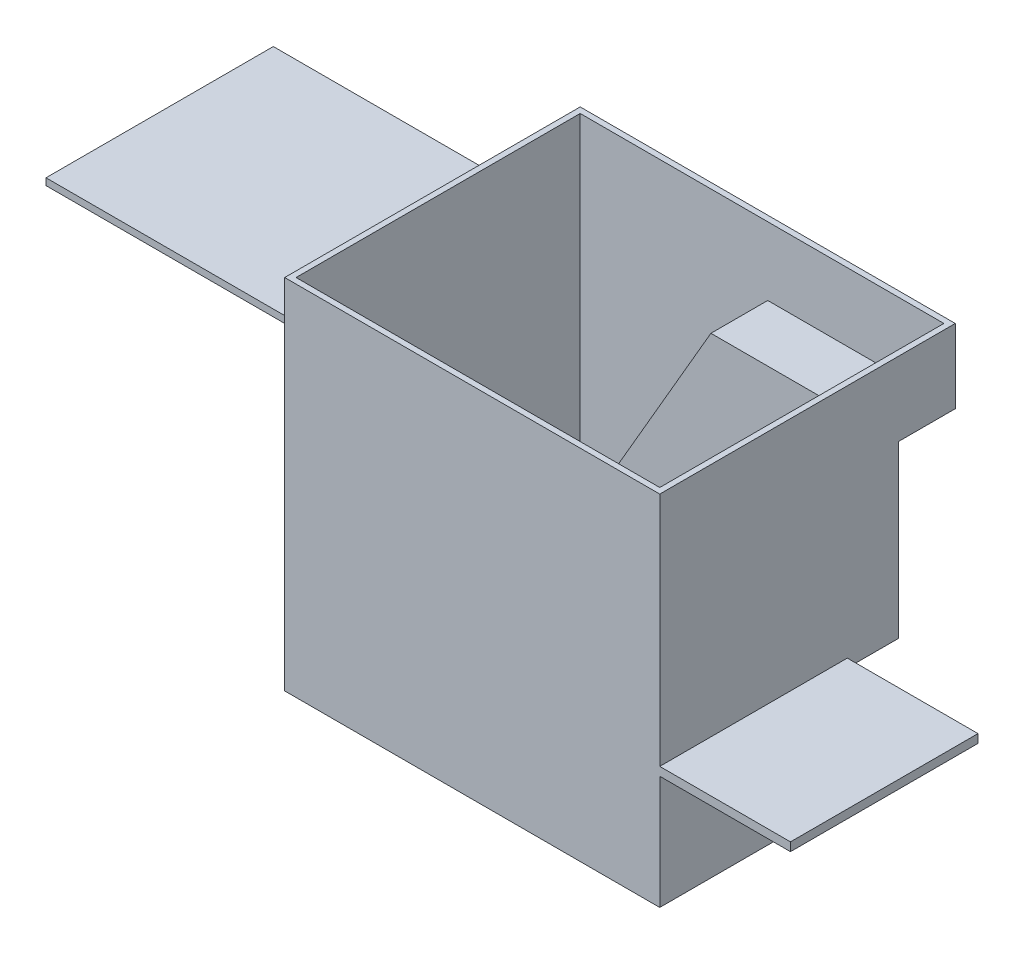
from build123d import *

# Parameters (mm, degrees)
EXTRUDE_1_DEPTH     = 10
SKETCH_2_W          = 10
SKETCH_2_H          = 510
EXTRUDE_2_DEPTH     = 500
EXTRUDE_3_DEPTH     = 10
EXTRUDE_4_DEPTH     = 190
SKETCH_5_W          = 640
SKETCH_5_H          = 10
EXTRUDE_5_DEPTH     = 200
CUT_EXTRUDE_1_DEPTH = 20
SKETCH_7_W          = 523.996532841
SKETCH_7_H          = 100
EXTRUDE_7_DEPTH     = 10
EXTRUDE_8_DEPTH     = 100
EXTRUDE_9_DEPTH     = 10
EXTRUDE_10_DEPTH    = 10
SKETCH_11_W         = 810
SKETCH_11_H         = 510
EXTRUDE_11_DEPTH    = 10
SKETCH_12_W         = 520
SKETCH_12_H         = 510
CUT_EXTRUDE_2_DEPTH = 120
SKETCH_13_W         = 520
SKETCH_13_H         = 510
CUT_EXTRUDE_3_DEPTH = 50
EXTRUDE_12_DEPTH    = 10
SKETCH_15_W         = 520
SKETCH_15_H         = 510
EXTRUDE_13_DEPTH    = 10
EXTRUDE_15_DEPTH    = 100
SKETCH_18_W         = 660
SKETCH_18_H         = 520
SKETCH_18_W_2       = 640
SKETCH_18_H_2       = 500
EXTRUDE_16_DEPTH    = 120
SKETCH_19_W         = 400
SKETCH_19_H         = 12
EXTRUDE_17_DEPTH    = 480
SKETCH_20_W         = 330
SKETCH_20_H         = 15
EXTRUDE_18_DEPTH    = 230


with BuildPart() as part:
    # 草图1 → 凸台-拉伸1 (new body)
    with BuildSketch(Plane(origin=(0, 0, 0), x_dir=(1, 0, 0), z_dir=(0, 1, 0))):
        Polygon((0, 300), (0, 510), (160, 510), (160, 320), (800, 320), (800, 0), (0, 0), align=None)
    extrude(amount=EXTRUDE_1_DEPTH)

    # 草图2 → 凸台-拉伸2 (add)
    with BuildSketch(Plane(origin=(0, 10, 0), x_dir=(1, 0, 0), z_dir=(0, 1, 0))):
        with Locations((5, 255)):
            Rectangle(SKETCH_2_W, SKETCH_2_H)
    extrude(amount=EXTRUDE_2_DEPTH)

    # 草图3 → 凸台-拉伸3 (add)
    with BuildSketch(Plane(origin=(0, 0, -510), x_dir=(-1, 0, 0), z_dir=(0, 0, -1))):
        Polygon((-10, 510), (-10, 10), (-160, 10), (-450.008667897, 510), align=None)
    extrude(amount=-EXTRUDE_3_DEPTH)

    # 草图4 → 凸台-拉伸4 (add)
    with BuildSketch(Plane(origin=(0, 0, -510), x_dir=(-1, 0, 0), z_dir=(0, 0, -1))):
        Polygon((-276.003467159, 210), (-160, 10), (-160, 0), (-169.762228515, 0), (-169.762228515, 10), (-285.765695674, 210), align=None)
    extrude(amount=-EXTRUDE_4_DEPTH)

    # 草图5 → 凸台-拉伸5 (add)
    with BuildSketch(Plane(origin=(0, 10, 0), x_dir=(1, 0, 0), z_dir=(0, 1, 0))):
        with Locations((480, 315)):
            Rectangle(SKETCH_5_W, SKETCH_5_H)
    extrude(amount=EXTRUDE_5_DEPTH)

    # 草图6 → 切除-拉伸1 (cut)
    with BuildSketch(Plane(origin=(0, 0, -320), x_dir=(-1, 0, 0), z_dir=(0, 0, -1))):
        Polygon((-160, 210), (-276.003467159, 210), (-160, 10), align=None)
    extrude(amount=-CUT_EXTRUDE_1_DEPTH, mode=Mode.SUBTRACT)

    # 草图7 → 凸台-拉伸7 (add)
    with BuildSketch(Plane(origin=(0, 210, 0), x_dir=(1, 0, 0), z_dir=(0, 1, 0))):
        with Locations((538.00173358, 360)):
            Rectangle(SKETCH_7_W, SKETCH_7_H)
    extrude(amount=-EXTRUDE_7_DEPTH)

    # 草图8 → 凸台-拉伸8 (add)
    with BuildSketch(Plane(origin=(0, 0, -510), x_dir=(-1, 0, 0), z_dir=(0, 0, -1))):
        Polygon((-276.003467159, 210), (-450.008667897, 510), (-459.770896412, 510), (-285.765695674, 210), align=None)
    extrude(amount=-EXTRUDE_8_DEPTH)

    # 草图9 → 凸台-拉伸9 (add)
    with BuildSketch(Plane.XY.offset(-410)):
        Polygon((276.003467159, 210), (450.008667897, 510), (800, 510), (800, 210), align=None)
    extrude(amount=EXTRUDE_9_DEPTH)

    # 草图10 → 凸台-拉伸10 (add)
    with BuildSketch(Plane(origin=(800, 0, 0), x_dir=(0, 0, -1), z_dir=(1, 0, 0))):
        Polygon((0, 0), (320, 0), (320, 200), (410, 200), (410, 510), (0, 510), align=None)
    extrude(amount=EXTRUDE_10_DEPTH)

    # 草图11 → 凸台-拉伸11 (add)
    with BuildSketch(Plane.XY):
        with Locations((405, 255)):
            Rectangle(SKETCH_11_W, SKETCH_11_H)
    extrude(amount=EXTRUDE_11_DEPTH)

    # 草图12 → 切除-拉伸2 (cut)
    with BuildSketch(Plane.ZY):
        with Locations((-250, 255)):
            Rectangle(SKETCH_12_W, SKETCH_12_H)
    extrude(amount=-CUT_EXTRUDE_2_DEPTH, mode=Mode.SUBTRACT)

    # 草图13 → 切除-拉伸3 (cut)
    with BuildSketch(Plane(origin=(810, 0, 0), x_dir=(0, 0, -1), z_dir=(1, 0, 0))):
        with Locations((250, 255)):
            Rectangle(SKETCH_13_W, SKETCH_13_H)
    extrude(amount=-CUT_EXTRUDE_3_DEPTH, mode=Mode.SUBTRACT)

    # 草图14 → 凸台-拉伸12 (add)
    with BuildSketch(Plane(origin=(760, 0, 0), x_dir=(0, 0, -1), z_dir=(1, 0, 0))):
        Polygon((-10, 510), (320, 510), (410, 510), (410, 200), (320, 200), (320, 0), (-10, 0), align=None)
    extrude(amount=EXTRUDE_12_DEPTH)

    # 草图15 → 凸台-拉伸13 (add)
    with BuildSketch(Plane.ZY.offset(-120)):
        with Locations((-250, 255)):
            Rectangle(SKETCH_15_W, SKETCH_15_H)
    extrude(amount=EXTRUDE_13_DEPTH)

    # 草图17 → 凸台-拉伸15 (add)
    with BuildSketch(Plane(origin=(0, 0, -410), x_dir=(-1, 0, 0), z_dir=(0, 0, -1))):
        Polygon((-770, 510), (-459.770896412, 510), (-453.970723054, 500), (-770, 500), align=None)
    extrude(amount=EXTRUDE_15_DEPTH)

    # 草图18 → 凸台-拉伸16 (add)
    with BuildSketch(Plane(origin=(0, 510, 0), x_dir=(1, 0, 0), z_dir=(0, 1, 0))):
        with Locations((440, 250)):
            Rectangle(SKETCH_18_W, SKETCH_18_H)
        with Locations((440, 250)):
            Rectangle(SKETCH_18_W_2, SKETCH_18_H_2, mode=Mode.SUBTRACT)
    extrude(amount=EXTRUDE_16_DEPTH)

    # 草图19 → 凸台-拉伸17 (add)
    with BuildSketch(Plane.ZY.offset(-110)):
        with Locations((-250, 506)):
            Rectangle(SKETCH_19_W, SKETCH_19_H)
    extrude(amount=EXTRUDE_17_DEPTH)

    # 草图20 → 凸台-拉伸18 (add)
    with BuildSketch(Plane(origin=(770, 0, 0), x_dir=(0, 0, -1), z_dir=(1, 0, 0))):
        with Locations((155, 207.5)):
            Rectangle(SKETCH_20_W, SKETCH_20_H)
    extrude(amount=EXTRUDE_18_DEPTH)


solid = part.part
